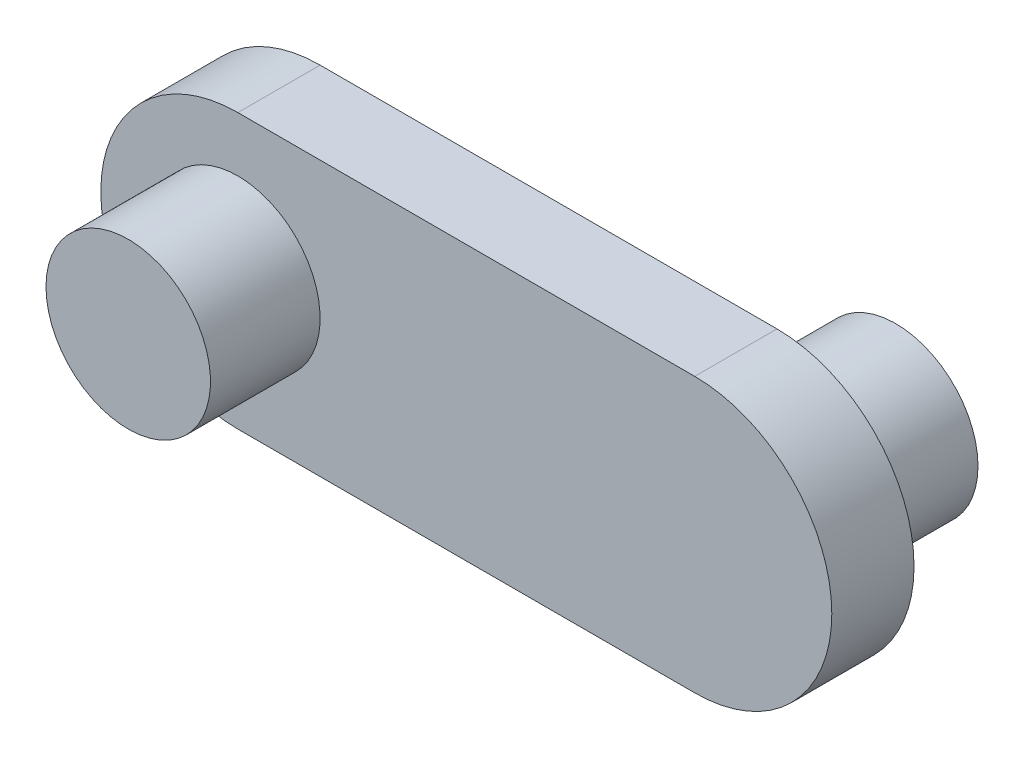
from build123d import *

# Parameters (mm, degrees)
SALIENTE_EXTRUIR1_DEPTH = 9
CROQUIS2_R              = 9
SALIENTE_EXTRUIR2_DEPTH = 12
CROQUIS2_2_R            = 9
SALIENTE_EXTRUIR3_DEPTH = 22


with BuildPart() as part:
    # Croquis1 → Saliente-Extruir1 (new body)
    with BuildSketch(Plane.XY):
        with BuildLine():
            Line((-8.792487614, 13.030881789), (41.207512386, 13.030881789))
            ThreePointArc((41.207512386, 13.030881789), (56.207512386, -1.969118211), (41.207512386, -16.969118211))
            Line((41.207512386, -16.969118211), (-8.792487614, -16.969118211))
            ThreePointArc((-8.792487614, -16.969118211), (-23.792487614, -1.969118211), (-8.792487614, 13.030881789))
        make_face()
    extrude(amount=SALIENTE_EXTRUIR1_DEPTH)

    # Croquis2 → Saliente-Extruir2 (add)
    with BuildSketch(Plane.XY.offset(9)):
        with Locations((-8.792487614, -1.969118211)):
            Circle(CROQUIS2_R)
    extrude(amount=SALIENTE_EXTRUIR2_DEPTH)

    # Croquis2<2> → Saliente-Extruir3 (add)
    with BuildSketch(Plane.XY.offset(9)):
        with Locations((41.207512386, -1.969118211)):
            Circle(CROQUIS2_2_R)
    extrude(amount=-SALIENTE_EXTRUIR3_DEPTH)


solid = part.part
